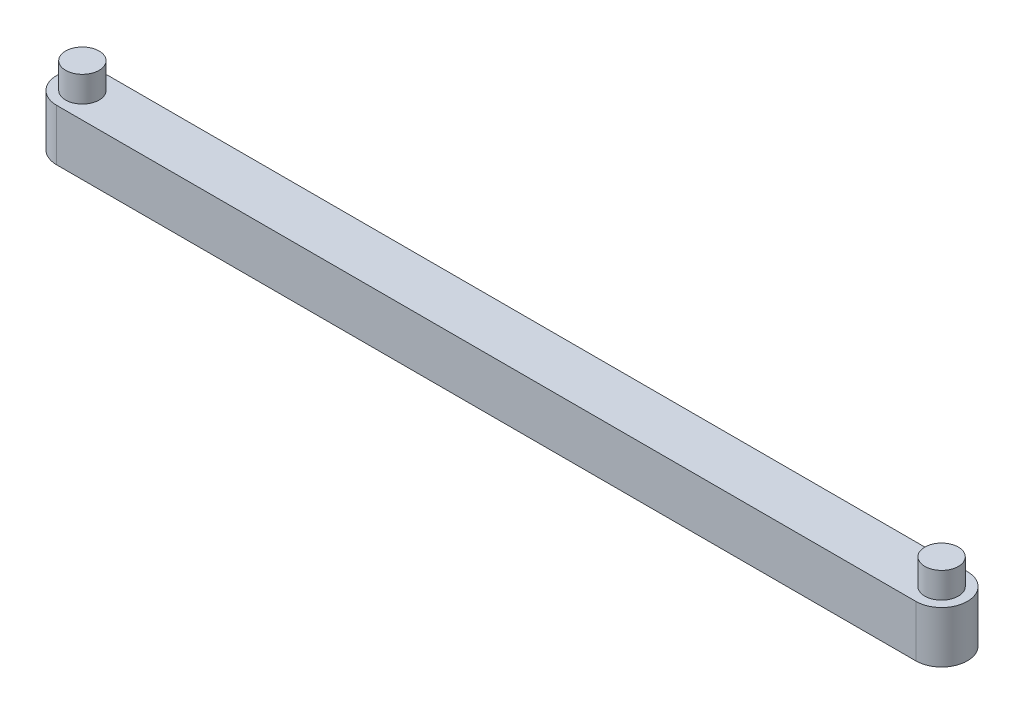
from build123d import *

# Parameters (mm, degrees)
BOSS_EXTRUDE1_DEPTH = 15
SKETCH2_R           = 9.75
BOSS_EXTRUDE2_DEPTH = 30
SKETCH2_2_R         = 9.75
CUT_EXTRUDE1_DEPTH  = 268.114207784
SKETCH2_3_R         = 9.75
BOSS_EXTRUDE3_DEPTH = 3


with BuildPart() as part:
    # Sketch1 → Boss-Extrude1 (new, symmetric)
    with BuildSketch(Plane(origin=(0, 0, 0), x_dir=(1, 0, 0), z_dir=(0, 1, 0))):
        with BuildLine():
            Line((-250, 15), (250, 15))
            ThreePointArc((250, 15), (265, 0), (250, -15))
            Line((250, -15), (-250, -15))
            ThreePointArc((-250, -15), (-265, 0), (-250, 15))
        make_face()
    extrude(amount=BOSS_EXTRUDE1_DEPTH, both=True)

    # Sketch2 → Boss-Extrude2 (add)
    with BuildSketch(Plane(origin=(0, 0, 0), x_dir=(1, 0, 0), z_dir=(0, 1, 0))):
        with Locations((-250, 0)):
            Circle(SKETCH2_R)
        with Locations((250, 0)):
            Circle(SKETCH2_R)
    extrude(amount=BOSS_EXTRUDE2_DEPTH)

    # Sketch2<2> → Cut-Extrude1 (cut, through all)
    with BuildSketch(Plane(origin=(0, 0, 0), x_dir=(1, 0, 0), z_dir=(0, 1, 0))):
        with Locations((-250, 0)):
            Circle(SKETCH2_2_R)
        with Locations((250, 0)):
            Circle(SKETCH2_2_R)
    extrude(amount=-CUT_EXTRUDE1_DEPTH, mode=Mode.SUBTRACT)

    # Sketch2<3> → Boss-Extrude3 (add)
    with BuildSketch(Plane(origin=(0, 0, 0), x_dir=(1, 0, 0), z_dir=(0, 1, 0))):
        with Locations((-250, 0)):
            Circle(SKETCH2_3_R)
        with Locations((250, 0)):
            Circle(SKETCH2_3_R)
    extrude(amount=-BOSS_EXTRUDE3_DEPTH)


solid = part.part
